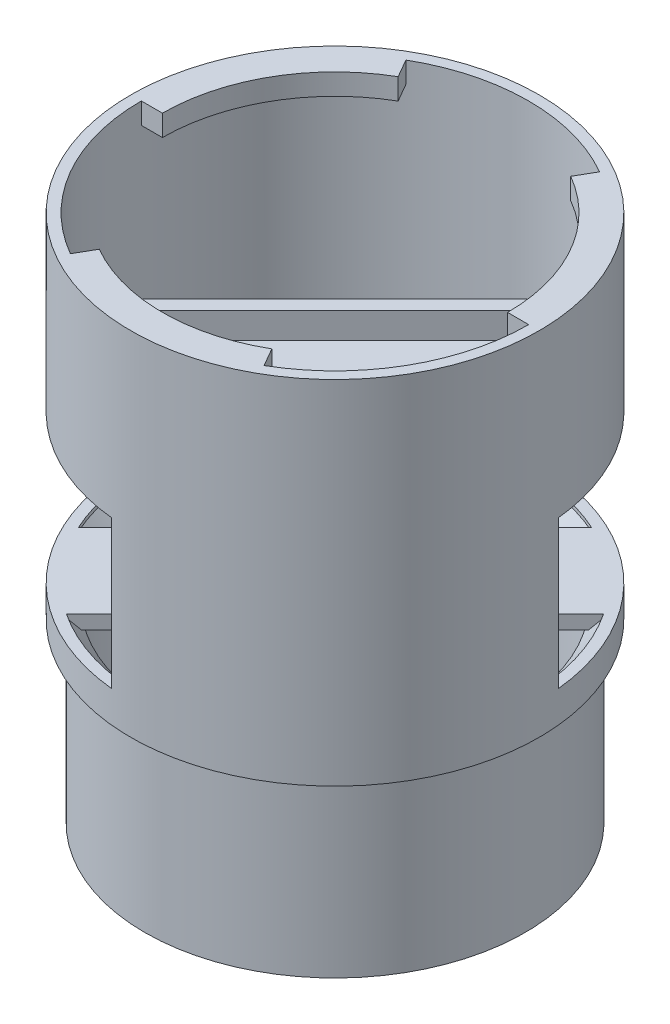
from build123d import *

# Parameters (mm, degrees)
SKETCH1_R                       = 27
SKETCH1_R_2                     = 25.5
BOSS_EXTRUDE3_DEPTH             = 25
SKETCH3_R                       = 1.75
SKETCH3_R_2                     = 5
BOSS_EXTRUDE4_DEPTH             = 6
CUT_EXTRUDE1_DEPTH              = 86.480992039
CUT_EXTRUDE1_DEPTH_BACK         = 86.480992039
SKETCH5_W                       = 36
SKETCH5_H                       = 21
BOSS_EXTRUDE6_REACH             = 87.481
SKETCH6_W                       = 2
SKETCH6_H                       = 21
SKETCH6_W_2                     = 15
SKETCH6_H_2                     = 2
SKETCH6_W_3                     = 15.441317486
BOSS_EXTRUDE6_DIRECTION_2_REACH = 87.481
BOSS_EXTRUDE7_START             = -3
BOSS_EXTRUDE7_DEPTH             = 3
CIRPATTERN1_COUNT               = 3
FILLET1_R                       = 10


with BuildPart() as part:
    # Sketch1 → Boss-Extrude3 (new body)
    with BuildSketch(Plane(origin=(0, 0, 0), x_dir=(1, 0, 0), z_dir=(0, 1, 0))):
        with Locations(Location((0, 0, 0), (0, 0, 270))):
            Circle(SKETCH1_R)
        with Locations(Location((0, 0, 0), (0, 0, 270))):
            Circle(SKETCH1_R_2, mode=Mode.SUBTRACT)
    extrude(amount=BOSS_EXTRUDE3_DEPTH)

    # Sketch3 → Boss-Extrude4 (add)
    with BuildSketch(Plane.XZ):
        with BuildLine():
            Line((-25.184320519, 4), (-14.456832295, 4))
            ThreePointArc((-14.456832295, 4), (-10.606601718, 10.606601718), (-4, 14.456832295))
            Line((-4, 14.456832295), (-4, 25.184320519))
            ThreePointArc((-4, 25.184320519), (0, 25.5), (4, 25.184320519))
            Line((4, 25.184320519), (4, 14.456832295))
            ThreePointArc((4, 14.456832295), (10.606601718, 10.606601718), (14.456832295, 4))
            Line((14.456832295, 4), (25.184320519, 4))
            ThreePointArc((25.184320519, 4), (25.5, 0), (25.184320519, -4))
            Line((25.184320519, -4), (14.456832295, -4))
            ThreePointArc((14.456832295, -4), (10.606601718, -10.606601718), (4, -14.456832295))
            Line((4, -14.456832295), (4, -25.184320519))
            ThreePointArc((4, -25.184320519), (0, -25.5), (-4, -25.184320519))
            Line((-4, -25.184320519), (-4, -14.456832295))
            ThreePointArc((-4, -14.456832295), (-10.606601718, -10.606601718), (-14.456832295, -4))
            Line((-14.456832295, -4), (-25.184320519, -4))
            ThreePointArc((-25.184320519, -4), (-25.5, 0), (-25.184320519, 4))
        make_face()
        with Locations(Location((-10, 0, 0), (0, 0, 270))):
            Circle(SKETCH3_R, mode=Mode.SUBTRACT)
        with Locations(Location((0, 10, 0), (0, 0, 270))):
            Circle(SKETCH3_R, mode=Mode.SUBTRACT)
        with Locations(Location((10, 0, 0), (0, 0, 270))):
            Circle(SKETCH3_R, mode=Mode.SUBTRACT)
        with Locations(Location((0, -10, 0), (0, 0, 270))):
            Circle(SKETCH3_R, mode=Mode.SUBTRACT)
        with Locations(Location((0, 0, 0), (0, 0, 270))):
            Circle(SKETCH3_R_2, mode=Mode.SUBTRACT)
    extrude(amount=-BOSS_EXTRUDE4_DEPTH)

    # Sketch4 → Revolve1 (revolve)
    with BuildSketch(Plane(origin=(0, 0, 0), x_dir=(0.7071067811865477, 0, 0.7071067811865475), z_dir=(-0.7071067811865475, 0, 0.7071067811865477)), mode=Mode.PRIVATE) as revolve1_sk:
        Polygon((-27, 25), (-29, 25), (-29, 75), (-27.5, 75), (-27.5, 29), (-25.5, 27), (-25.5, 25), align=None)
    revolve(revolve1_sk.sketch.rotate(Axis((0, 0, 0), (0, 1, 0)), 315), axis=Axis((0, 0, 0), (0, 1, 0)))

    # Sketch5 → Cut-Extrude1 (cut, two sides: drawn at the far end of the back side and taken through both)
    with BuildSketch(Plane(origin=(0, 0, 0), x_dir=(0.7071067811865477, 0, 0.7071067811865475), z_dir=(-0.7071067811865475, 0, 0.7071067811865477)).offset(-CUT_EXTRUDE1_DEPTH_BACK)):
        with Locations((0.3887064, 40)):
            Rectangle(SKETCH5_W, SKETCH5_H)
    extrude(amount=CUT_EXTRUDE1_DEPTH + CUT_EXTRUDE1_DEPTH_BACK, mode=Mode.SUBTRACT)

    # Sketch6 → Boss-Extrude6 (add, up to next)
    with BuildSketch(Plane(origin=(0, 0, 0), x_dir=(0.7071067811865477, 0, 0.7071067811865475), z_dir=(-0.7071067811865475, 0, 0.7071067811865477)), mode=Mode.PRIVATE) as boss_extrude6_sk1:
        with Locations((-18.6112936, 40)):
            Rectangle(SKETCH6_W, SKETCH6_H)
    boss_extrude6_tool1 = extrude(boss_extrude6_sk1.sketch, amount=-BOSS_EXTRUDE6_REACH, mode=Mode.PRIVATE) - part.part
    # Sketch6 → Boss-Extrude6 (add, up to next)
    with BuildSketch(Plane(origin=(0, 0, 0), x_dir=(0.7071067811865477, 0, 0.7071067811865475), z_dir=(-0.7071067811865475, 0, 0.7071067811865477)), mode=Mode.PRIVATE) as boss_extrude6_sk2:
        with Locations((-2.1112936, 28.5)):
            Rectangle(SKETCH6_W_2, SKETCH6_H_2)
    boss_extrude6_tool2 = extrude(boss_extrude6_sk2.sketch, amount=-BOSS_EXTRUDE6_REACH, mode=Mode.PRIVATE) - part.part
    # Sketch6 → Boss-Extrude6 (add, up to next)
    with BuildSketch(Plane(origin=(0, 0, 0), x_dir=(0.7071067811865477, 0, 0.7071067811865475), z_dir=(-0.7071067811865475, 0, 0.7071067811865477)), mode=Mode.PRIVATE) as boss_extrude6_sk3:
        with Locations((-1.890634857, 51.5)):
            Rectangle(SKETCH6_W_3, SKETCH6_H_2)
    boss_extrude6_tool3 = extrude(boss_extrude6_sk3.sketch, amount=-BOSS_EXTRUDE6_REACH, mode=Mode.PRIVATE) - part.part
    add(boss_extrude6_tool1.solids().sort_by_distance((-13.160172, 40, -13.160172))[0])
    add(boss_extrude6_tool2.solids().sort_by_distance((-1.49291, 28.5, -1.49291))[0])
    add(boss_extrude6_tool3.solids().sort_by_distance((-1.336881, 51.5, -1.336881))[0])

    # Sketch6 → Boss-Extrude6 direction 2 (add, up to next)
    with BuildSketch(Plane(origin=(0, 0, 0), x_dir=(0.7071067811865477, 0, 0.7071067811865475), z_dir=(-0.7071067811865475, 0, 0.7071067811865477)), mode=Mode.PRIVATE) as boss_extrude6_direction_2_sk1:
        with Locations((-18.6112936, 40)):
            Rectangle(SKETCH6_W, SKETCH6_H)
    boss_extrude6_direction_2_tool1 = extrude(boss_extrude6_direction_2_sk1.sketch, amount=BOSS_EXTRUDE6_DIRECTION_2_REACH, mode=Mode.PRIVATE) - part.part
    # Sketch6 → Boss-Extrude6 direction 2 (add, up to next)
    with BuildSketch(Plane(origin=(0, 0, 0), x_dir=(0.7071067811865477, 0, 0.7071067811865475), z_dir=(-0.7071067811865475, 0, 0.7071067811865477)), mode=Mode.PRIVATE) as boss_extrude6_direction_2_sk2:
        with Locations((-2.1112936, 28.5)):
            Rectangle(SKETCH6_W_2, SKETCH6_H_2)
    boss_extrude6_direction_2_tool2 = extrude(boss_extrude6_direction_2_sk2.sketch, amount=BOSS_EXTRUDE6_DIRECTION_2_REACH, mode=Mode.PRIVATE) - part.part
    # Sketch6 → Boss-Extrude6 direction 2 (add, up to next)
    with BuildSketch(Plane(origin=(0, 0, 0), x_dir=(0.7071067811865477, 0, 0.7071067811865475), z_dir=(-0.7071067811865475, 0, 0.7071067811865477)), mode=Mode.PRIVATE) as boss_extrude6_direction_2_sk3:
        with Locations((-1.890634857, 51.5)):
            Rectangle(SKETCH6_W_3, SKETCH6_H_2)
    boss_extrude6_direction_2_tool3 = extrude(boss_extrude6_direction_2_sk3.sketch, amount=BOSS_EXTRUDE6_DIRECTION_2_REACH, mode=Mode.PRIVATE) - part.part
    add(boss_extrude6_direction_2_tool1.solids().sort_by_distance((-13.160172, 40, -13.160172))[0])
    add(boss_extrude6_direction_2_tool2.solids().sort_by_distance((-1.49291, 28.5, -1.49291))[0])
    add(boss_extrude6_direction_2_tool3.solids().sort_by_distance((-1.336881, 51.5, -1.336881))[0])

    # Sketch7 → Boss-Extrude7 (add)
    with BuildSketch(Plane(origin=(0, 75, 0), x_dir=(1, 0, 0), z_dir=(0, 1, 0)).offset(BOSS_EXTRUDE7_START)):
        with BuildLine():
            Line((-27.5, 0), (-24.5, 0))
            ThreePointArc((-24.5, 0), (-21.217622393, 12.25), (-12.25, 21.217622393))
            Line((-12.25, 21.217622393), (-13.75, 23.815698604))
            ThreePointArc((-13.75, 23.815698604), (-23.815698604, 13.75), (-27.5, 0))
        make_face()
    boss_extrude7 = extrude(amount=BOSS_EXTRUDE7_DEPTH)

    # CirPattern1: Boss-Extrude7 ×3 about axis
    cirpattern1_axis = Axis((0, 0, 0), (0, 1, 0))
    for i in range(1, CIRPATTERN1_COUNT):
        add(boss_extrude7.rotate(cirpattern1_axis, i * 360 / CIRPATTERN1_COUNT))

    # Fillet1
    fillet1_edges = [part.edges().sort_by_distance(p)[0] for p in [
        (-25.5, 6, 0),
        (-2.006218678, 6, 25.420957626),
        (25.5, 6, 0),
        (0, 6, -25.5),
    ]]
    fillet(fillet1_edges, radius=FILLET1_R)


solid = part.part
